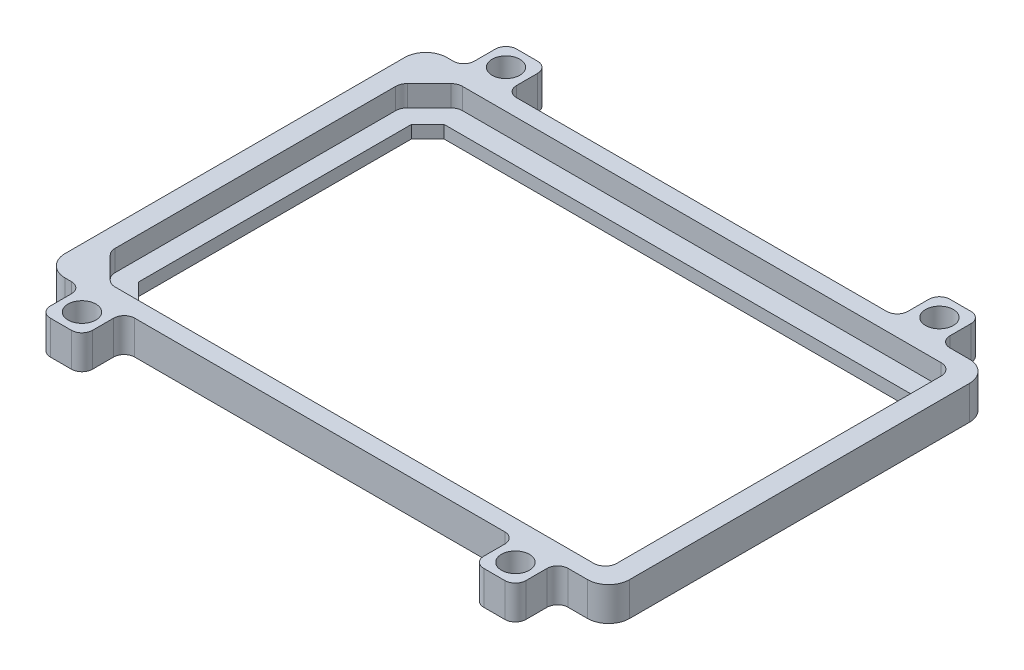
from build123d import *

# Parameters (mm, degrees)
SKETCH1_W            = 157.0786
SKETCH1_H            = 90.551
BOSS_EXTRUDE1_DEPTH  = 8
CUT_EXTRUDE21_DEPTH  = 5
FILLET8_R            = 2.75
SKETCH29_W           = 11.58993
SKETCH29_H           = 90.551
CUT_EXTRUDE25_DEPTH  = 182.486005463
FILLET9_R            = 5
SKETCH36_W           = 10
SKETCH36_H           = 10
SKETCH36_R           = 3.3
BOSS_EXTRUDE10_DEPTH = 8
FILLET10_R           = 2.5
CUT_EXTRUDE26_DEPTH  = 3


with BuildPart() as part:
    # Sketch1 → Boss-Extrude1 (new body)
    with BuildSketch(Plane(origin=(0, 0, 0), x_dir=(1, 0, 0), z_dir=(0, 1, 0))):
        with Locations((78.5393, -45.2755)):
            Rectangle(SKETCH1_W, SKETCH1_H)
    extrude(amount=BOSS_EXTRUDE1_DEPTH)

    # Sketch23 → Cut-Extrude21 (cut)
    with BuildSketch(Plane(origin=(0, 8, 0), x_dir=(1, 0, 0), z_dir=(0, 1, 0))):
        Polygon((140.6288, -86.4755), (23.2359173, -86.4755), (16.4498, -79.6893827), (16.4498, -10.8616173), (23.2359173, -4.0755), (140.6288, -4.0755), align=None)
    extrude(amount=-CUT_EXTRUDE21_DEPTH, mode=Mode.SUBTRACT)

    # Fillet8
    fillet8_edges = [part.edges().sort_by_distance(p)[0] for p in [
        (140.6288, 5.5, 4.0755),
        (140.6288, 5.5, 86.4755),
        (23.2359173, 5.5, 86.4755),
        (16.4498, 5.5, 79.6893827),
        (16.4498, 5.5, 10.8616173),
        (23.2359173, 5.5, 4.0755),
    ]]
    fillet(fillet8_edges, radius=FILLET8_R)

    # Sketch29 → Cut-Extrude25 (cut, through all)
    with BuildSketch(Plane(origin=(0, 8, 0), x_dir=(1, 0, 0), z_dir=(0, 1, 0))):
        with Locations((151.283635, -45.2755)):
            Rectangle(SKETCH29_W, SKETCH29_H)
        with Locations((5.794965, -45.2755)):
            Rectangle(SKETCH29_W, SKETCH29_H)
    extrude(amount=-CUT_EXTRUDE25_DEPTH, mode=Mode.SUBTRACT)

    # Fillet9
    fillet9_edges = [part.edges().sort_by_distance(p)[0] for p in [
        (145.48867, 4, 90.551),
        (145.48867, 4, 0),
        (11.58993, 4, 0),
        (11.58993, 4, 90.551),
    ]]
    fillet(fillet9_edges, radius=FILLET9_R)

    # Sketch36 → Boss-Extrude10 (add)
    # profile 1 of 4: a face of its own
    with BuildSketch(Plane.XZ):
        with Locations((25.6082, 95.551)):
            Rectangle(SKETCH36_W, SKETCH36_H)
        with Locations(Location((25.6082, 95.551, 0), (0, 0, 270))):
            Circle(SKETCH36_R, mode=Mode.SUBTRACT)
    # profile 2 of 4: a face of its own
    with BuildSketch(Plane.XZ):
        with Locations((128.3942697, 95.551)):
            Rectangle(SKETCH36_W, SKETCH36_H)
        with Locations(Location((128.3942697, 95.551, 0), (0, 0, 270))):
            Circle(SKETCH36_R, mode=Mode.SUBTRACT)
    # profile 3 of 4: a face of its own
    with BuildSketch(Plane.XZ):
        with Locations((25.6082, -5)):
            Rectangle(SKETCH36_W, SKETCH36_H)
        with Locations(Location((25.6082, -5, 0), (0, 0, 270))):
            Circle(SKETCH36_R, mode=Mode.SUBTRACT)
    # profile 4 of 4: a face of its own
    with BuildSketch(Plane.XZ):
        with Locations((128.3942697, -5)):
            Rectangle(SKETCH36_W, SKETCH36_H)
        with Locations(Location((128.3942697, -5, 0), (0, 0, 270))):
            Circle(SKETCH36_R, mode=Mode.SUBTRACT)
    extrude(amount=-BOSS_EXTRUDE10_DEPTH)

    # Fillet10
    fillet10_edges = [part.edges().sort_by_distance(p)[0] for p in [
        (20.6082, 4, 90.551),
        (20.6082, 4, 100.551),
        (30.6082, 4, 100.551),
        (30.6082, 4, 90.551),
        (123.3942697, 4, 90.551),
        (123.3942697, 4, 100.551),
        (133.3942697, 4, 100.551),
        (133.3942697, 4, 90.551),
        (30.6082, 4, 0),
        (30.6082, 4, -10),
        (20.6082, 4, -10),
        (20.6082, 4, 0),
        (123.3942697, 4, -10),
        (123.3942697, 4, 0),
        (133.3942697, 4, 0),
        (133.3942697, 4, -10),
    ]]
    fillet(fillet10_edges, radius=FILLET10_R)

    # Sketch37 → Cut-Extrude26 (cut)
    with BuildSketch(Plane(origin=(0, 3, 0), x_dir=(1, 0, 0), z_dir=(0, 1, 0))):
        Polygon((21.1393, -77.618314888), (24.996485112, -81.4755), (135.9393, -81.4755), (135.9393, -9.0755), (24.996485112, -9.0755), (21.1393, -12.932685112), align=None)
    extrude(amount=-CUT_EXTRUDE26_DEPTH, mode=Mode.SUBTRACT)


solid = part.part
